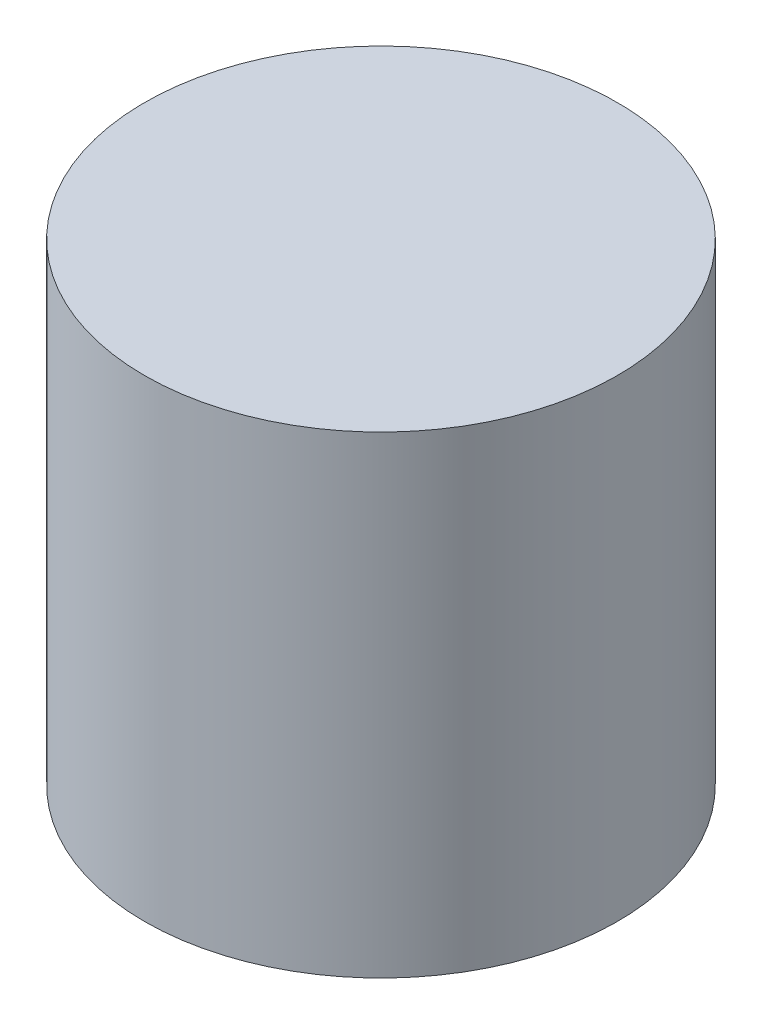
from build123d import *

# Parameters (mm, degrees)
SKETCH_1_R          = 92.5
EXTRUDE_1_DEPTH     = 185
SKETCH_2_R          = 50
CUT_EXTRUDE_1_DEPTH = 50


with BuildPart() as part:
    # 草图1 → 凸台-拉伸1 (new body)
    with BuildSketch(Plane(origin=(0, 0, 0), x_dir=(1, 0, 0), z_dir=(0, 1, 0))):
        with Locations(Location((0, 0, 0), (0, 0, 270))):
            Circle(SKETCH_1_R)
    extrude(amount=EXTRUDE_1_DEPTH)

    # 草图2 → 切除-拉伸1 (cut)
    with BuildSketch(Plane(origin=(0, 0, 0), x_dir=(-1, 0, 0), z_dir=(0, -1, 0))):
        with Locations(Location((0, 0, 0), (0, 0, 90))):
            Circle(SKETCH_2_R)
    extrude(amount=-CUT_EXTRUDE_1_DEPTH, mode=Mode.SUBTRACT)


solid = part.part
